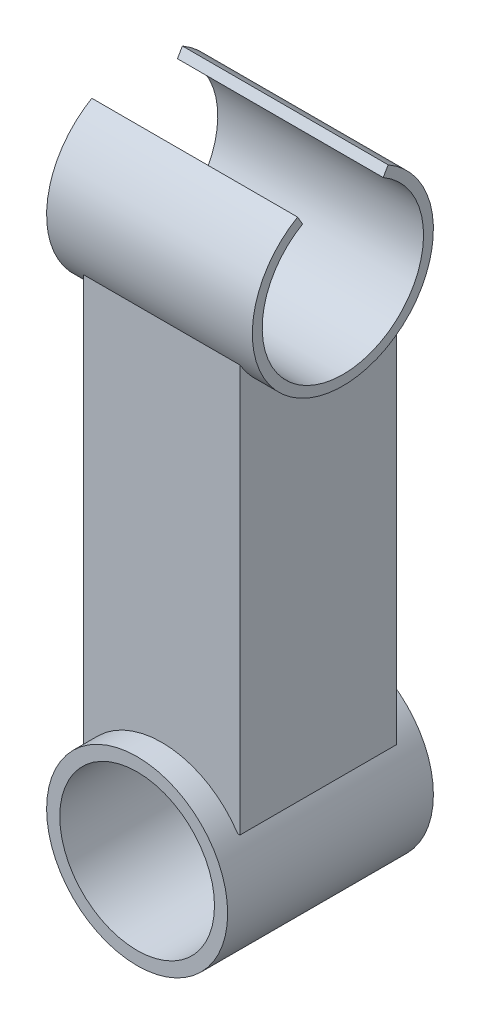
from build123d import *

# Parameters (mm, degrees)
BOSS_EXTRUDE1_DEPTH = 12.5
SKETCH3_W           = 19
SKETCH3_H           = 19
SKETCH3_W_2         = 15.8
SKETCH3_H_2         = 15.8
BOSS_EXTRUDE3_DEPTH = 55
SKETCH2_R           = 11
SKETCH2_R_2         = 9.4
BOSS_EXTRUDE2_DEPTH = 12.5
SKETCH4_R           = 9.8
CUT_EXTRUDE1_DEPTH  = 20
SKETCH5_R           = 9.4
CUT_EXTRUDE2_DEPTH  = 20


with BuildPart() as part:
    # Sketch1 → Boss-Extrude1 (new, symmetric)
    with BuildSketch(Plane(origin=(0, 0, 0), x_dir=(0, 0, -1), z_dir=(1, 0, 0))):
        with BuildLine():
            Line((-5.5, 9.526279442), (-4.9, 8.487048957))
            ThreePointArc((-4.9, 8.487048957), (0, -9.8), (4.9, 8.487048957))
            Line((4.9, 8.487048957), (5.5, 9.526279442))
            ThreePointArc((5.5, 9.526279442), (0, -11), (-5.5, 9.526279442))
        make_face()
    extrude(amount=BOSS_EXTRUDE1_DEPTH, both=True)

    # Sketch3 → Boss-Extrude3 (add)
    with BuildSketch(Plane(origin=(0, 0, 0), x_dir=(1, 0, 0), z_dir=(0, 1, 0))):
        Rectangle(SKETCH3_W, SKETCH3_H)
        Rectangle(SKETCH3_W_2, SKETCH3_H_2, mode=Mode.SUBTRACT)
    extrude(amount=-BOSS_EXTRUDE3_DEPTH)

    # Sketch2 → Boss-Extrude2 (add, symmetric)
    with BuildSketch(Plane.XY):
        with Locations((0, -61)):
            Circle(SKETCH2_R)
        with Locations((0, -61)):
            Circle(SKETCH2_R_2, mode=Mode.SUBTRACT)
    extrude(amount=BOSS_EXTRUDE2_DEPTH, both=True)

    # Sketch4 → Cut-Extrude1 (cut, symmetric)
    with BuildSketch(Plane(origin=(0, 0, 0), x_dir=(0, 0, -1), z_dir=(1, 0, 0))):
        Circle(SKETCH4_R)
    extrude(amount=CUT_EXTRUDE1_DEPTH, both=True, mode=Mode.SUBTRACT)

    # Sketch5 → Cut-Extrude2 (cut, symmetric)
    with BuildSketch(Plane.XY):
        with Locations((0, -61)):
            Circle(SKETCH5_R)
    extrude(amount=CUT_EXTRUDE2_DEPTH, both=True, mode=Mode.SUBTRACT)


solid = part.part
